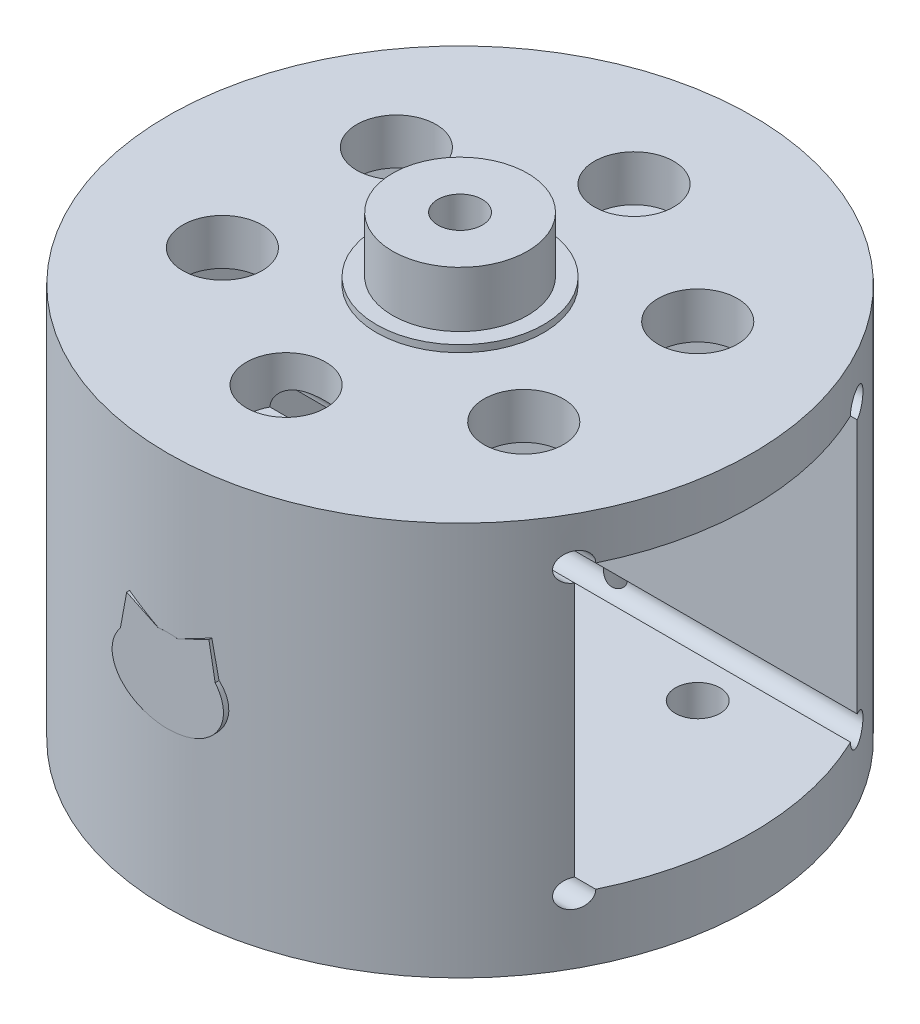
from build123d import *

# Parameters (mm, degrees)
SKETCH_1_R                      = 14.75
EXTRUDE_1_DEPTH                 = 4.2
SKETCH_2_R                      = 21
EXTRUDE_2_DEPTH                 = 25
CUT_EXTRUDE_1_DEPTH             = 20.3
SKETCH_5_R                      = 1.6
CUT_EXTRUDE_2_DEPTH             = 42.649009592
SKETCH_6_R                      = 21
EXTRUDE_3_DEPTH                 = 3.3
SKETCH_8_R                      = 6
EXTRUDE_4_DEPTH                 = 0.5
SKETCH_9_R                      = 4.85
EXTRUDE_5_DEPTH                 = 4
CUT_EXTRUDE_START               = -37
SKETCH_7_R                      = 2.85
CUT_EXTRUDE_3_DEPTH             = 7.8
CUT_EXTRUDE_4_REACH             = 49.445
SKETCH_10_R                     = 1.6
CUT_EXTRUDE_4_DIRECTION_2_DEPTH = 48.444704657
CUT_EXTRUDE_START_2             = -28.1
SKETCH_11_W                     = 6.3
SKETCH_11_H                     = 6.3
CUT_EXTRUDE_5_DEPTH             = 6.3
EXTRUDE_START                   = 20
EXTRUDE_6_DEPTH                 = 1
SKETCH_15_R                     = 1
CUT_EXTRUDE_6_DEPTH             = 58.714816444


with BuildPart() as part:
    # 草图1 → 凸台-拉伸1 (new body)
    with BuildSketch(Plane(origin=(0, 0, 0), x_dir=(1, 0, 0), z_dir=(0, 1, 0))):
        with Locations(Location((0, 0, 0), (0, 0, 270))):
            Circle(SKETCH_1_R)
    extrude(amount=EXTRUDE_1_DEPTH)

    # 草图2 → 凸台-拉伸2 (add)
    with BuildSketch(Plane(origin=(0, 4.2, 0), x_dir=(1, 0, 0), z_dir=(0, 1, 0))):
        with Locations(Location((0, 0, 0), (0, 0, 270))):
            Circle(SKETCH_2_R)
    extrude(amount=EXTRUDE_2_DEPTH)

    # 草图4 → 切除-拉伸1 (cut)
    with BuildSketch(Plane(origin=(0, 29.2, 0), x_dir=(1, 0, 0), z_dir=(0, 1, 0))):
        Polygon((-18, 10.15), (18, 10.15), (116.242263293, 10.15), (116.242263293, -10.15), (18, -10.15), (-18, -10.15), align=None)
    extrude(amount=-CUT_EXTRUDE_1_DEPTH, mode=Mode.SUBTRACT)

    # 草图5 → 切除-拉伸2 (cut, through all)
    with BuildSketch(Plane.XZ):
        with Locations(Location((0, 12.5, 0), (0, 0, 270))):
            Circle(SKETCH_5_R)
        with Locations(Location((10.825317547, 6.25, 0), (0, 0, 270))):
            Circle(SKETCH_5_R)
        with Locations(Location((10.825317547, -6.25, 0), (0, 0, 270))):
            Circle(SKETCH_5_R)
        with Locations(Location((0, -12.5, 0), (0, 0, 270))):
            Circle(SKETCH_5_R)
        with Locations(Location((-10.825317547, -6.25, 0), (0, 0, 270))):
            Circle(SKETCH_5_R)
        with Locations(Location((-10.825317547, 6.25, 0), (0, 0, 270))):
            Circle(SKETCH_5_R)
    extrude(amount=-CUT_EXTRUDE_2_DEPTH, mode=Mode.SUBTRACT)

    # 草图6 → 凸台-拉伸3 (add)
    with BuildSketch(Plane(origin=(0, 29.2, 0), x_dir=(1, 0, 0), z_dir=(0, 1, 0))):
        with Locations(Location((0, 0, 0), (0, 0, 270))):
            Circle(SKETCH_6_R)
    extrude(amount=EXTRUDE_3_DEPTH)

    # 草图8 → 凸台-拉伸4 (add)
    with BuildSketch(Plane(origin=(0, 32.5, 0), x_dir=(1, 0, 0), z_dir=(0, 1, 0))):
        with Locations(Location((0, 0, 0), (0, 0, 270))):
            Circle(SKETCH_8_R)
    extrude(amount=EXTRUDE_4_DEPTH)

    # 草图9 → 凸台-拉伸5 (add)
    with BuildSketch(Plane(origin=(0, 33, 0), x_dir=(1, 0, 0), z_dir=(0, 1, 0))):
        with Locations(Location((0, 0, 0), (0, 0, 270))):
            Circle(SKETCH_9_R)
    extrude(amount=EXTRUDE_5_DEPTH)

    # 草图7 → 切除-拉伸3 (cut)
    with BuildSketch(Plane.XZ.offset(CUT_EXTRUDE_START)):
        with Locations(Location((-10.825317547, 6.25, 0), (0, 0, 90))):
            Circle(SKETCH_7_R)
        with Locations(Location((10.825317547, 6.25, 0), (0, 0, 90))):
            Circle(SKETCH_7_R)
        with Locations(Location((10.825317547, -6.25, 0), (0, 0, 90))):
            Circle(SKETCH_7_R)
        with Locations(Location((-10.825317547, -6.25, 0), (0, 0, 90))):
            Circle(SKETCH_7_R)
        with Locations(Location((0, 12.5, 0), (0, 0, 90))):
            Circle(SKETCH_7_R)
        with Locations(Location((0, -12.5, 0), (0, 0, 90))):
            Circle(SKETCH_7_R)
    extrude(amount=CUT_EXTRUDE_3_DEPTH, mode=Mode.SUBTRACT)

    # 草图10 → 切除-拉伸4 (cut, up to next)
    with BuildSketch(Plane(origin=(0, 37, 0), x_dir=(1, 0, 0), z_dir=(0, 1, 0)), mode=Mode.PRIVATE) as cut_extrude_4_sk1:
        with Locations(Location((0, 0, 0), (0, 0, 90))):
            Circle(SKETCH_10_R)
    cut_extrude_4_tool1 = extrude(cut_extrude_4_sk1.sketch, amount=-CUT_EXTRUDE_4_REACH, mode=Mode.PRIVATE) & part.part
    add(cut_extrude_4_tool1.solids().sort_by_distance((0, 37, 0))[0], mode=Mode.SUBTRACT)

    # 草图10 → 切除-拉伸4 direction 2 (cut)
    with BuildSketch(Plane(origin=(0, 37, 0), x_dir=(1, 0, 0), z_dir=(0, 1, 0))):
        with Locations(Location((0, 0, 0), (0, 0, 90))):
            Circle(SKETCH_10_R)
    extrude(amount=CUT_EXTRUDE_4_DIRECTION_2_DEPTH, mode=Mode.SUBTRACT)

    # 草图11 → 切除-拉伸5 (cut)
    with BuildSketch(Plane(origin=(0, 37, 0), x_dir=(1, 0, 0), z_dir=(0, 1, 0)).offset(CUT_EXTRUDE_START_2)):
        Rectangle(SKETCH_11_W, SKETCH_11_H)
    extrude(amount=-CUT_EXTRUDE_5_DEPTH, mode=Mode.SUBTRACT)

    # 草图14 → 凸台-拉伸6 (add)
    with BuildSketch(Plane.XY.offset(EXTRUDE_START)):
        with BuildLine():
            Line((-2.954769624, 22.383526555), (-3.40491347, 19.924386356))
            add(Edge.make_bspline(
                [(-3.40491347, 19.924386356), (-7.165153372, 15.35), (0, 15.35), (7.165153372, 15.35), (3.40491347, 19.924386356)],
                knots=[5.730710509, 5.730710509, 5.730710509, 7.853981634, 7.853981634, 9.977252759, 9.977252759, 9.977252759], degree=2, weights=[1, 0.487444637, 1, 0.487444637, 1]))
            Line((3.40491347, 19.924386356), (2.954769624, 22.383526555))
            Line((2.954769624, 22.383526555), (0.7, 21.3037053))
            add(Edge.make_bspline(
                [(0.7, 21.3037053), (0, 21.397020297), (-0.7, 21.3037053)],
                knots=[4.536483212, 4.536483212, 4.536483212, 4.888294749, 4.888294749, 4.888294749], degree=2, weights=[1, 0.984568433, 1]))
            Line((-0.7, 21.3037053), (-2.954769624, 22.383526555))
        make_face()
    extrude(amount=EXTRUDE_6_DEPTH)

    # 草图15 → 切除-拉伸6 (cut, through all)
    with BuildSketch(Plane(origin=(-18, 0, 0), x_dir=(0, 0, -1), z_dir=(1, 0, 0))):
        with Locations((-10.15, 29.2)):
            Circle(SKETCH_15_R)
        with Locations((10.15, 29.2)):
            Circle(SKETCH_15_R)
        with Locations((-10.15, 8.9)):
            Circle(SKETCH_15_R)
        with Locations((10.15, 8.9)):
            Circle(SKETCH_15_R)
    extrude(amount=CUT_EXTRUDE_6_DEPTH, mode=Mode.SUBTRACT)


solid = part.part
